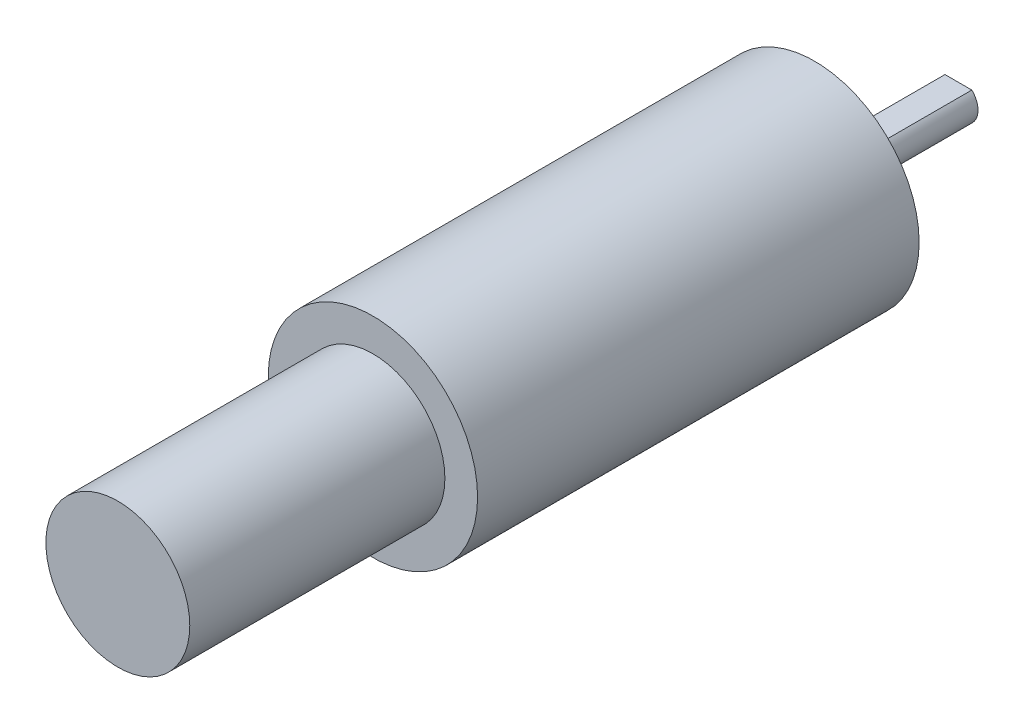
from build123d import *

# Parameters (mm, degrees)
SKETCH1_R           = 16
BOSS_EXTRUDE1_DEPTH = 67.5
SKETCH2_R           = 9
BOSS_EXTRUDE2_DEPTH = 1
SKETCH3_R           = 3
BOSS_EXTRUDE3_DEPTH = 21
CUT_EXTRUDE1_DEPTH  = 17.698
SKETCH5_R           = 11
BOSS_EXTRUDE4_DEPTH = 39
CIRPATTERN1_COUNT   = 4


with BuildPart() as part:
    # Sketch1 → Boss-Extrude1 (new body)
    with BuildSketch(Plane.XY):
        Circle(SKETCH1_R)
    extrude(amount=BOSS_EXTRUDE1_DEPTH)

    # Sketch2 → Boss-Extrude2 (add)
    with BuildSketch(Plane(origin=(0, 0, 0), x_dir=(-1, 0, 0), z_dir=(0, 0, -1))):
        with Locations(Location((0, 0, 0), (0, 0, 180))):
            Circle(SKETCH2_R)
    extrude(amount=BOSS_EXTRUDE2_DEPTH)

    # Sketch3 → Boss-Extrude3 (add)
    with BuildSketch(Plane(origin=(0, 0, -1), x_dir=(-1, 0, 0), z_dir=(0, 0, -1))):
        with Locations(Location((0, 0, 0), (0, 0, 180))):
            Circle(SKETCH3_R)
    extrude(amount=BOSS_EXTRUDE3_DEPTH)

    # Sketch4 → Cut-Extrude1 (cut)
    with BuildSketch(Plane(origin=(0, 0, -22), x_dir=(-1, 0, 0), z_dir=(0, 0, -1))):
        Polygon((-3.161861974, 2.187315475), (3.465054218, 2.187315475), (3.465054218, 5.609056515), align=None)
    extrude(amount=-CUT_EXTRUDE1_DEPTH, mode=Mode.SUBTRACT)

    # Sketch5 → Boss-Extrude4 (add)
    with BuildSketch(Plane.XY.offset(67.5)):
        Circle(SKETCH5_R)
    extrude(amount=BOSS_EXTRUDE4_DEPTH)

    # Sketch8 → M3x0.5 Tapped Hole1 (revolve, cut)
    with BuildSketch(Plane(origin=(0, 13, 0), x_dir=(0, 1, 0), z_dir=(1, 0, 0))):
        Polygon((0, 0), (0, 8.371075774), (1.25, 7.62), (1.25, 0), align=None)
    m3x0_5_tapped_hole1 = revolve(axis=Axis((0, 13, -6.35), (0, 0, 1)), mode=Mode.SUBTRACT)

    # CirPattern1: M3x0.5 Tapped Hole1 ×4 about axis
    cirpattern1_axis = Axis((0, 0, 0), (0, 0, 1))
    for i in range(1, CIRPATTERN1_COUNT):
        add(m3x0_5_tapped_hole1.rotate(cirpattern1_axis, i * 360 / CIRPATTERN1_COUNT), mode=Mode.SUBTRACT)


solid = part.part
